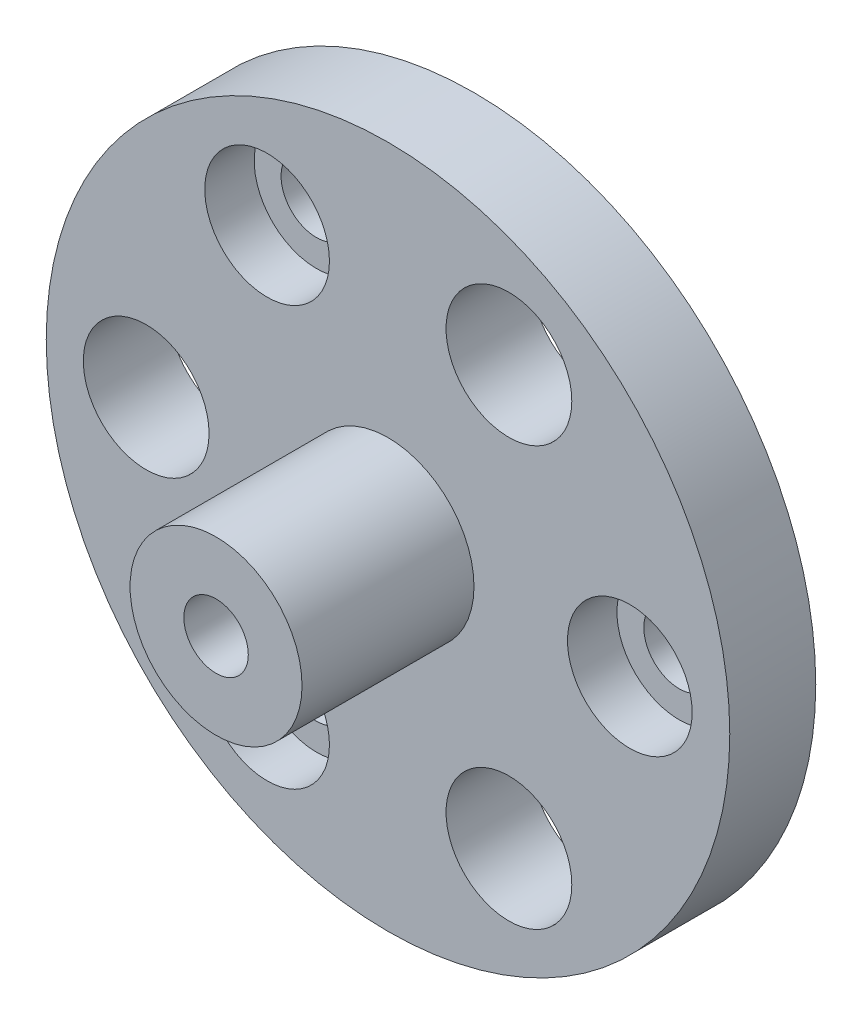
from build123d import *

# Parameters (mm, degrees)
CROQUIS1_R              = 15.9
CROQUIS1_R_2            = 2.925
CROQUIS1_R_3            = 1.65
CROQUIS1_R_4            = 1.5
SALIENTE_EXTRUIR1_DEPTH = 4
CROQUIS3_R              = 4
CROQUIS3_R_2            = 1.5
SALIENTE_EXTRUIR3_DEPTH = 8
CROQUIS4_R              = 2.9
CORTAR_EXTRUIR2_DEPTH   = 2.3


with BuildPart() as part:
    # Croquis1 → Saliente-Extruir1 (new body)
    with BuildSketch(Plane.XY.offset(998.15499802)):
        with Locations((2.956072514, 15.206748875)):
            Circle(CROQUIS1_R)
        with Locations((-8.293927486, 15.206748875)):
            Circle(CROQUIS1_R_2, mode=Mode.SUBTRACT)
        with Locations((14.206072514, 15.206748875)):
            Circle(CROQUIS1_R_3, mode=Mode.SUBTRACT)
        with Locations((-2.668927486, 5.463963082)):
            Circle(CROQUIS1_R_3, mode=Mode.SUBTRACT)
        with Locations((-2.668927486, 24.949534667)):
            Circle(CROQUIS1_R_3, mode=Mode.SUBTRACT)
        with Locations((8.581072514, 24.949534667)):
            Circle(CROQUIS1_R_2, mode=Mode.SUBTRACT)
        with Locations((2.956072514, 15.206748875)):
            Circle(CROQUIS1_R_4, mode=Mode.SUBTRACT)
        with Locations((8.581072514, 5.463963082)):
            Circle(CROQUIS1_R_2, mode=Mode.SUBTRACT)
    extrude(amount=SALIENTE_EXTRUIR1_DEPTH)

    # Croquis3 → Saliente-Extruir3 (add)
    with BuildSketch(Plane.XY.offset(1002.15499802)):
        with Locations((2.956072514, 15.206748875)):
            Circle(CROQUIS3_R)
        with Locations((2.956072514, 15.206748875)):
            Circle(CROQUIS3_R_2, mode=Mode.SUBTRACT)
    extrude(amount=SALIENTE_EXTRUIR3_DEPTH)

    # Croquis4 → Cortar-Extruir2 (cut)
    with BuildSketch(Plane.XY.offset(1002.15499802)):
        with Locations((-2.668927486, 24.949534667)):
            Circle(CROQUIS4_R)
        with Locations((14.206072514, 15.206748875)):
            Circle(CROQUIS4_R)
        with Locations((-2.668927486, 5.463963082)):
            Circle(CROQUIS4_R)
    extrude(amount=-CORTAR_EXTRUIR2_DEPTH, mode=Mode.SUBTRACT)


solid = part.part
